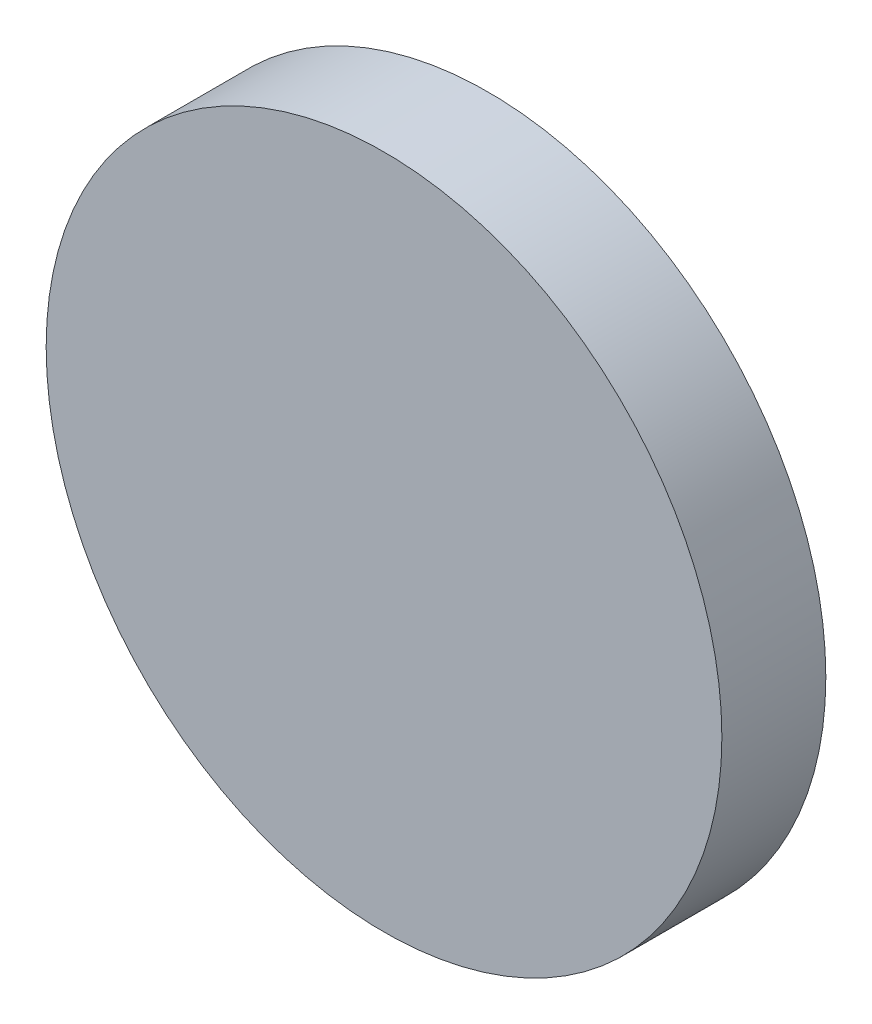
from build123d import *

# Parameters (mm, degrees)
SKETCH_1_R      = 3.25
EXTRUDE_1_DEPTH = 1


with BuildPart() as part:
    # 草图1 → 凸台-拉伸1 (new body)
    with BuildSketch(Plane.XY):
        Circle(SKETCH_1_R)
    extrude(amount=EXTRUDE_1_DEPTH)


solid = part.part
